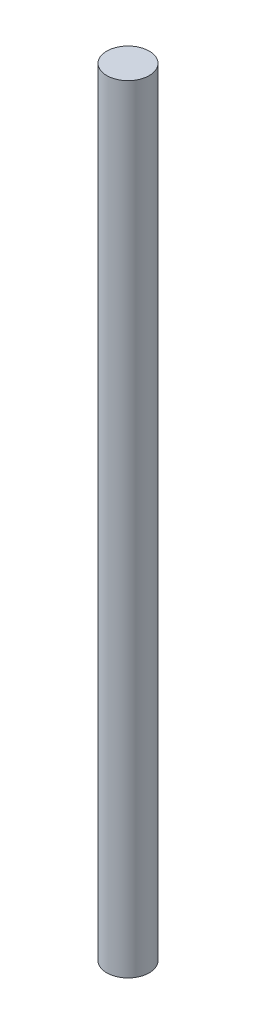
from build123d import *

# Parameters (mm, degrees)
SKETCH1_R           = 2.0828
BOSS_EXTRUDE1_DEPTH = 76.2


with BuildPart() as part:
    # Sketch1 → Boss-Extrude1 (new body)
    with BuildSketch(Plane(origin=(0, 0, 0), x_dir=(1, 0, 0), z_dir=(0, 1, 0))):
        with Locations(Location((0, 0, 0), (0, 0, 90))):
            Circle(SKETCH1_R)
    extrude(amount=BOSS_EXTRUDE1_DEPTH)


solid = part.part
